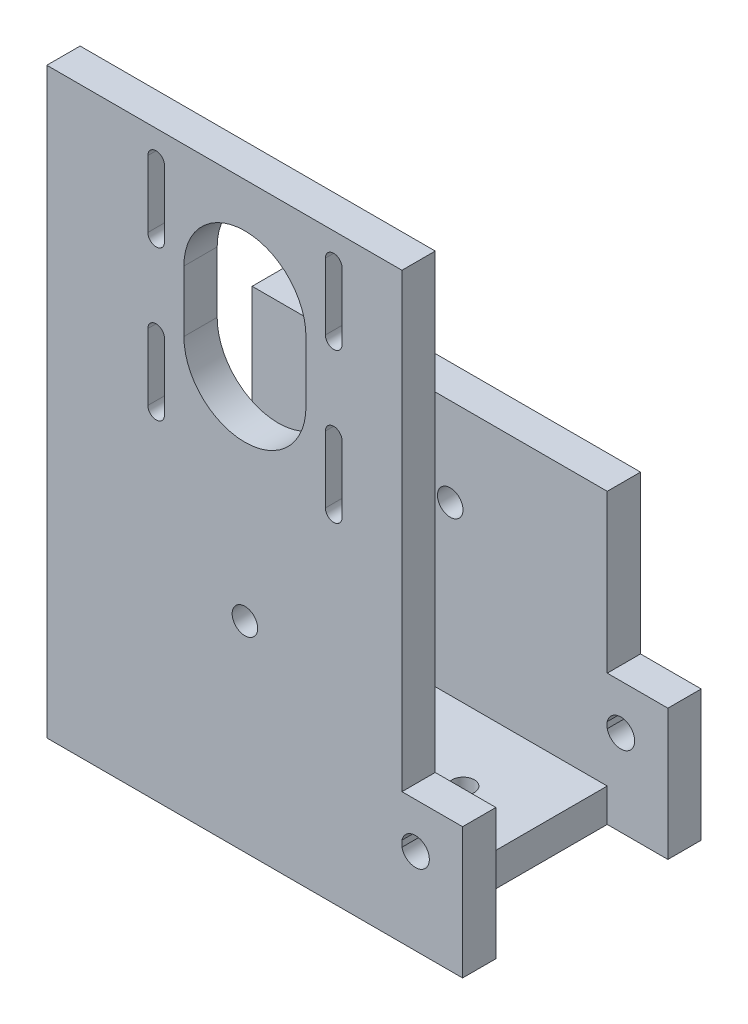
from build123d import *

# Parameters (mm, degrees)
CROQUIS1_W              = 64
CROQUIS1_H              = 43
CROQUIS1_R              = 2
SALIENTE_EXTRUIR1_DEPTH = 6
CROQUIS2_W              = 64
CROQUIS2_H              = 6
SALIENTE_EXTRUIR2_DEPTH = 99
CROQUIS3_R              = 2.3
CORTAR_EXTRUIR1_DEPTH   = 118.889779031
SALIENTE_EXTRUIR3_DEPTH = 6
CROQUIS5_W              = 64
CROQUIS5_H              = 6
SALIENTE_EXTRUIR4_DEPTH = 46
CORTAR_EXTRUIR2_START   = -6
CROQUIS6_R              = 2.3
CORTAR_EXTRUIR2_DEPTH   = 6
SALIENTE_EXTRUIR5_START = -6
SALIENTE_EXTRUIR5_DEPTH = 6


with BuildPart() as part:
    # Croquis1 → Saliente-Extruir1 (new body)
    with BuildSketch(Plane(origin=(0, 0, 0), x_dir=(1, 0, 0), z_dir=(0, 1, 0))):
        Rectangle(CROQUIS1_W, CROQUIS1_H)
        with Locations(Location((19.040268394, 2.5, 0), (0, 0, 270))):
            Circle(CROQUIS1_R, mode=Mode.SUBTRACT)
        with Locations(Location((-13.040268394, 2.5, 0), (0, 0, 90))):
            Circle(CROQUIS1_R, mode=Mode.SUBTRACT)
    extrude(amount=SALIENTE_EXTRUIR1_DEPTH)

    # Croquis2 → Saliente-Extruir2 (add)
    with BuildSketch(Plane(origin=(0, 6, 0), x_dir=(1, 0, 0), z_dir=(0, 1, 0))):
        with Locations((0, -18.5)):
            Rectangle(CROQUIS2_W, CROQUIS2_H)
    extrude(amount=SALIENTE_EXTRUIR2_DEPTH)

    # Croquis3 → Cortar-Extruir1 (cut, through all)
    with BuildSketch(Plane.XY.offset(21.5)):
        with Locations((3.7, 36.1)):
            Circle(CROQUIS3_R)
        with BuildLine():
            Line((-7.3, 75), (-7.3, 86))
            ThreePointArc((-7.3, 86), (3.7, 97), (14.7, 86))
            Line((14.7, 86), (14.7, 75))
            ThreePointArc((14.7, 75), (3.7, 64), (-7.3, 75))
        make_face()
        with BuildLine():
            Line((-13.8, 88), (-13.8, 100))
            ThreePointArc((-13.8, 100), (-12.3, 101.5), (-10.8, 100))
            Line((-10.8, 100), (-10.8, 88))
            ThreePointArc((-10.8, 88), (-12.3, 86.5), (-13.8, 88))
        make_face()
        with BuildLine():
            Line((-13.8, 73), (-13.8, 61))
            ThreePointArc((-13.8, 61), (-12.3, 59.5), (-10.8, 61))
            Line((-10.8, 61), (-10.8, 73))
            ThreePointArc((-10.8, 73), (-12.3, 74.5), (-13.8, 73))
        make_face()
        with BuildLine():
            Line((21.2, 88), (21.2, 100))
            ThreePointArc((21.2, 100), (19.7, 101.5), (18.2, 100))
            Line((18.2, 100), (18.2, 88))
            ThreePointArc((18.2, 88), (19.7, 86.5), (21.2, 88))
        make_face()
        with BuildLine():
            Line((21.2, 73), (21.2, 61))
            ThreePointArc((21.2, 61), (19.7, 59.5), (18.2, 61))
            Line((18.2, 61), (18.2, 73))
            ThreePointArc((18.2, 73), (19.7, 74.5), (21.2, 73))
        make_face()
    extrude(amount=-CORTAR_EXTRUIR1_DEPTH, mode=Mode.SUBTRACT)

    # Croquis4 → Saliente-Extruir3 (add)
    with BuildSketch(Plane.XY.offset(21.5)):
        with BuildLine():
            Line((32, 0), (42.927948292, 0))
            Line((42.927948292, 0), (42.927948292, 23.616164973))
            Line((42.927948292, 23.616164973), (32, 23.616164973))
            Line((32, 23.616164973), (32, 16.055291722))
            ThreePointArc((32, 16.055291722), (36.937550226, 15.5), (32, 14.944708278))
            Line((32, 14.944708278), (32, 0))
        make_face()
    extrude(amount=-SALIENTE_EXTRUIR3_DEPTH)

    # Croquis5 → Saliente-Extruir4 (add)
    with BuildSketch(Plane(origin=(0, 6, 0), x_dir=(1, 0, 0), z_dir=(0, 1, 0))):
        with Locations((0, 18.5)):
            Rectangle(CROQUIS5_W, CROQUIS5_H)
    extrude(amount=SALIENTE_EXTRUIR4_DEPTH)

    # Croquis6 → Cortar-Extruir2 (cut)
    with BuildSketch(Plane(origin=(0, 0, -21.5), x_dir=(-1, 0, 0), z_dir=(0, 0, -1)).offset(CORTAR_EXTRUIR2_START)):
        with Locations(Location((-3.7, 36.1, 0), (0, 0, 180))):
            Circle(CROQUIS6_R)
    extrude(amount=CORTAR_EXTRUIR2_DEPTH, mode=Mode.SUBTRACT)

    # Croquis7 → Saliente-Extruir5 (add)
    with BuildSketch(Plane(origin=(0, 0, -21.5), x_dir=(-1, 0, 0), z_dir=(0, 0, -1)).offset(SALIENTE_EXTRUIR5_START)):
        with BuildLine():
            Line((-32, 23.616164973), (-42.927948292, 23.616164973))
            Line((-42.927948292, 23.616164973), (-42.927948292, 0))
            Line((-42.927948292, 0), (-32, 0))
            Line((-32, 0), (-32, 14.944708278))
            ThreePointArc((-32, 14.944708278), (-36.937550226, 15.5), (-32, 16.055291722))
            Line((-32, 16.055291722), (-32, 23.616164973))
        make_face()
    extrude(amount=SALIENTE_EXTRUIR5_DEPTH)


solid = part.part
